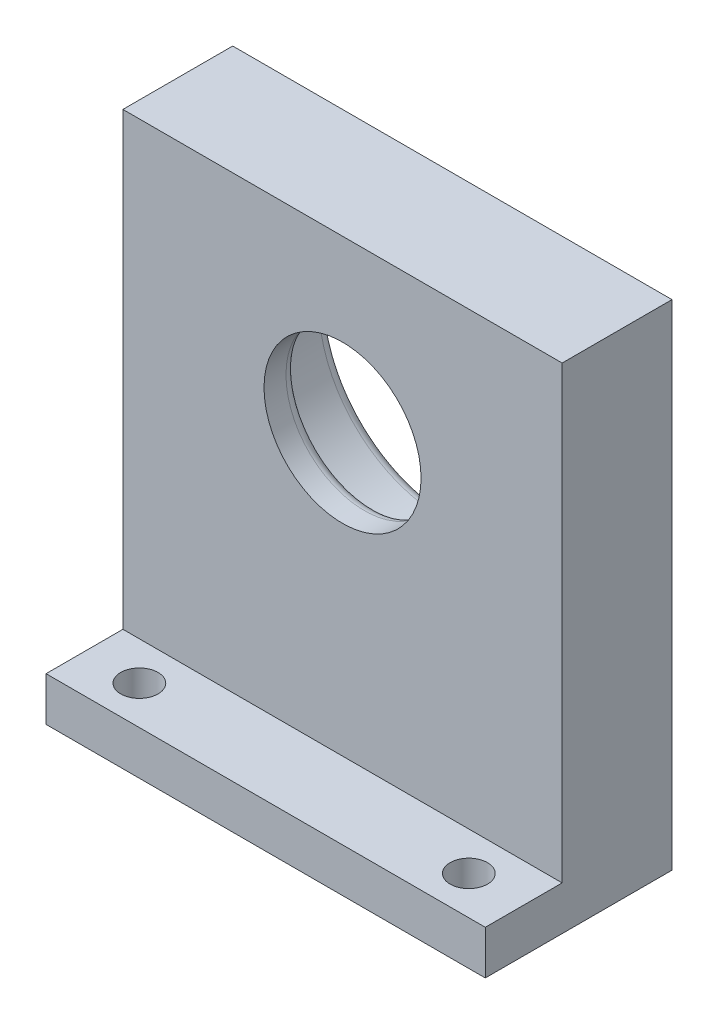
from build123d import *

# Parameters (mm, degrees)
SKETCH1_W           = 40
SKETCH1_H           = 45
SKETCH1_R           = 11.15
BOSS_EXTRUDE1_DEPTH = 7
SKETCH2_W           = 40
SKETCH2_H           = 45
SKETCH2_R           = 7.15
BOSS_EXTRUDE2_DEPTH = 3
FILLET1_R           = 1
SKETCH3_W           = 40
SKETCH3_H           = 4
BOSS_EXTRUDE3_DEPTH = 7
SKETCH4_R           = 1.7
CUT_EXTRUDE1_DEPTH  = 49.682645779


with BuildPart() as part:
    # Sketch1 → Boss-Extrude1 (new body)
    with BuildSketch(Plane.XY):
        Rectangle(SKETCH1_W, SKETCH1_H)
        with Locations((0, 7)):
            Circle(SKETCH1_R, mode=Mode.SUBTRACT)
    extrude(amount=BOSS_EXTRUDE1_DEPTH)

    # Sketch2 → Boss-Extrude2 (add)
    with BuildSketch(Plane.XY.offset(7)):
        Rectangle(SKETCH2_W, SKETCH2_H)
        with Locations((0, 7)):
            Circle(SKETCH2_R, mode=Mode.SUBTRACT)
    extrude(amount=BOSS_EXTRUDE2_DEPTH)

    # Fillet1
    fillet1_edges = [part.edges().sort_by_distance(p)[0] for p in [
        (-11.15, 7, 0),
        (-7.15, 7, 7),
    ]]
    fillet(fillet1_edges, radius=FILLET1_R)

    # Sketch3 → Boss-Extrude3 (add)
    with BuildSketch(Plane.XY.offset(10)):
        with Locations((0, -20.5)):
            Rectangle(SKETCH3_W, SKETCH3_H)
    extrude(amount=BOSS_EXTRUDE3_DEPTH)

    # Sketch4 → Cut-Extrude1 (cut, through all)
    with BuildSketch(Plane(origin=(0, -18.5, 0), x_dir=(1, 0, 0), z_dir=(0, 1, 0))):
        with Locations(Location((-15, -13.5, 0), (0, 0, 270))):
            Circle(SKETCH4_R)
        with Locations(Location((15, -13.5, 0), (0, 0, 270))):
            Circle(SKETCH4_R)
    extrude(amount=-CUT_EXTRUDE1_DEPTH, mode=Mode.SUBTRACT)


solid = part.part
